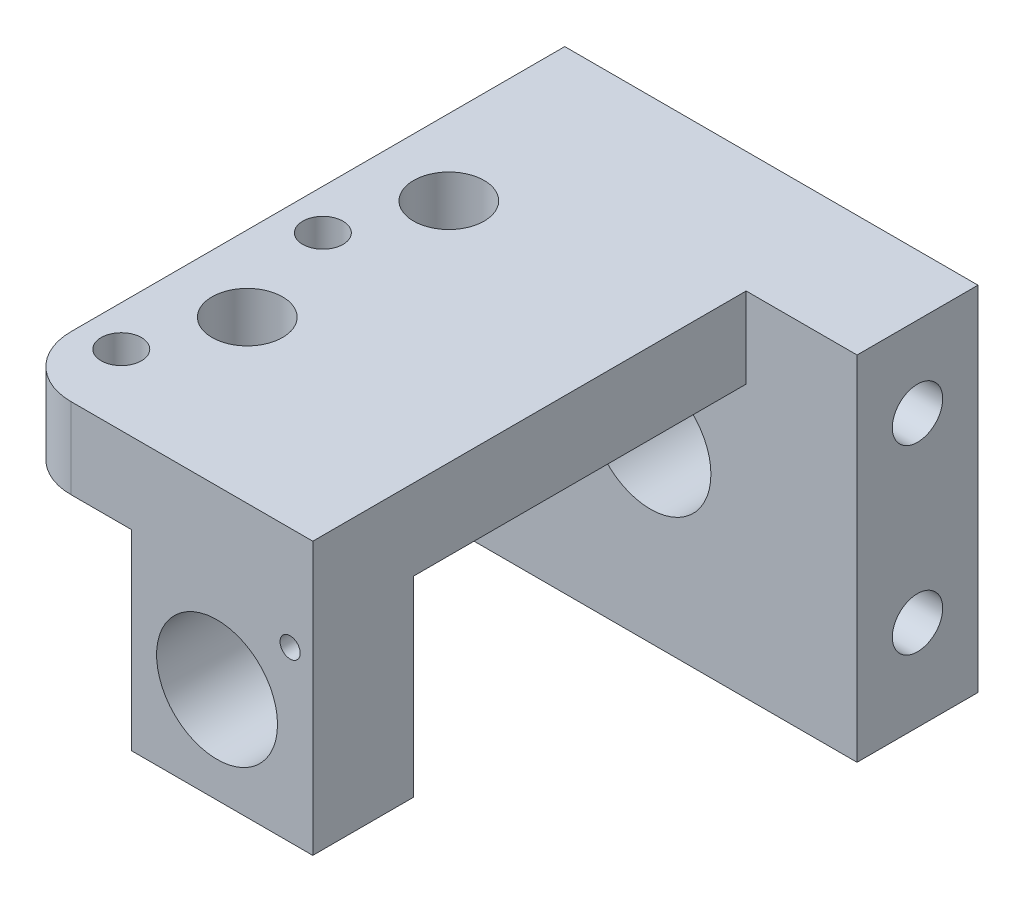
from build123d import *

# Parameters (mm, degrees)
SKETCH_1_W                     = 41
SKETCH_1_H                     = 35
EXTRUDE_1_DEPTH                = 12
SKETCH_2_W                     = 30
SKETCH_2_H                     = 55
EXTRUDE_2_DEPTH                = 8
SKETCH_3_W                     = 18
SKETCH_3_H                     = 19
EXTRUDE_3_DEPTH                = 10
FILLET_1_R                     = 6
F_4_0MM_1_D                    = 4
HOLE_WIZARD_7_0_7_1_AT_2_COUNT = 2
HOLE_WIZARD_7_0_7_1_AT_2_PITCH = 20
SKETCH_9_R                     = 1
CUT_EXTRUDE_1_DEPTH            = 10
HOLE_WIZARD_M6_1_AT_2_COUNT    = 2
HOLE_WIZARD_M6_1_AT_2_PITCH    = 18
SKETCH_12_R                    = 6
CUT_EXTRUDE_2_DEPTH            = 62.249489794


with BuildPart() as part:
    # 草图1 → 凸台-拉伸1 (new body)
    with BuildSketch(Plane.XY):
        Rectangle(SKETCH_1_W, SKETCH_1_H)
    extrude(amount=EXTRUDE_1_DEPTH)

    # 草图2 → 凸台-拉伸2 (add)
    with BuildSketch(Plane(origin=(0, 17.5, 0), x_dir=(1, 0, 0), z_dir=(0, 1, 0))):
        with Locations((-5.5, -27.5)):
            Rectangle(SKETCH_2_W, SKETCH_2_H)
    extrude(amount=-EXTRUDE_2_DEPTH)

    # 草图3 → 凸台-拉伸3 (add)
    with BuildSketch(Plane.XY.offset(55)):
        with Locations((0.5, 0)):
            Rectangle(SKETCH_3_W, SKETCH_3_H)
    extrude(amount=-EXTRUDE_3_DEPTH)

    # 圆角1
    fillet_1_edges = [part.edges().sort_by_distance(p)[0] for p in [
        (-20.5, 13.5, 55),
    ]]
    fillet(fillet_1_edges, radius=FILLET_1_R)

    # Ø4.0mm 暗销孔1 (through all)
    with Locations(Plane(origin=(0, 17.5, 0), x_dir=(1, 0, 0), z_dir=(0, 1, 0))):
        with Locations((-16.5, -48), (-16.5, -28)):
            Hole(F_4_0MM_1_D / 2)

    # 草图8 → Ø7.0 (7) 直径孔1 (revolve, cut)
    with BuildSketch(Plane(origin=(-13, 17.5, 39), x_dir=(0, 0, 1), z_dir=(1, 0, 0))):
        Polygon((0, 0), (0, 8), (5.5, 8), (3.5, 6), (3.5, 0), align=None)
    hole_wizard_7_0_7_1 = revolve(axis=Axis((-13, 23.85, 39), (0, -1, 0)), mode=Mode.SUBTRACT)

    # Ø7.0 (7) 直径孔1 at 2: Ø7.0 (7) 直径孔1 ×2
    with Locations(*[(0, 0, -i * HOLE_WIZARD_7_0_7_1_AT_2_PITCH) for i in range(1, HOLE_WIZARD_7_0_7_1_AT_2_COUNT)]):
        add(hole_wizard_7_0_7_1, mode=Mode.SUBTRACT)

    # 草图9 → 切除-拉伸1 (cut)
    with BuildSketch(Plane.XY.offset(55)):
        with Locations((7.25, 7.25)):
            Circle(SKETCH_9_R)
    extrude(amount=-CUT_EXTRUDE_1_DEPTH, mode=Mode.SUBTRACT)

    # 草图11 → M6 螺纹孔1 (revolve, cut)
    with BuildSketch(Plane(origin=(20.5, 9.5, 6), x_dir=(0, 0, -1), z_dir=(0, 1, 0))):
        Polygon((0, 0), (0, 13.502151548), (2.5, 12), (2.5, 0), align=None)
    hole_wizard_m6_1 = revolve(axis=Axis((26.85, 9.5, 6), (-1, 0, 0)), mode=Mode.SUBTRACT)

    # M6 螺纹孔1 at 2: M6 螺纹孔1 ×2
    with Locations(*[(0, -i * HOLE_WIZARD_M6_1_AT_2_PITCH, 0) for i in range(1, HOLE_WIZARD_M6_1_AT_2_COUNT)]):
        add(hole_wizard_m6_1, mode=Mode.SUBTRACT)

    # 镜向1: M6 螺纹孔1 across plane
    add(hole_wizard_m6_1.mirror(Plane(origin=(0, 0, 0), x_dir=(0, 0, 1), z_dir=(1, 0, 0))), mode=Mode.SUBTRACT)

    # 镜向1 copy 1 sketch → 镜向1 copy 1 (revolve, cut)
    with BuildSketch(Plane(origin=(-20.5, -8.5, 6), x_dir=(0, 0, -1), z_dir=(0, 1, 0))):
        Polygon((0, 0), (0, -13.502151548), (2.5, -12), (2.5, 0), align=None)
    revolve(axis=Axis((-26.85, -8.5, 6), (-1, 0, 0)), mode=Mode.SUBTRACT)

    # 草图12 → 切除-拉伸2 (cut, through all)
    with BuildSketch(Plane.XY.offset(55)):
        Circle(SKETCH_12_R)
    extrude(amount=-CUT_EXTRUDE_2_DEPTH, mode=Mode.SUBTRACT)


solid = part.part
